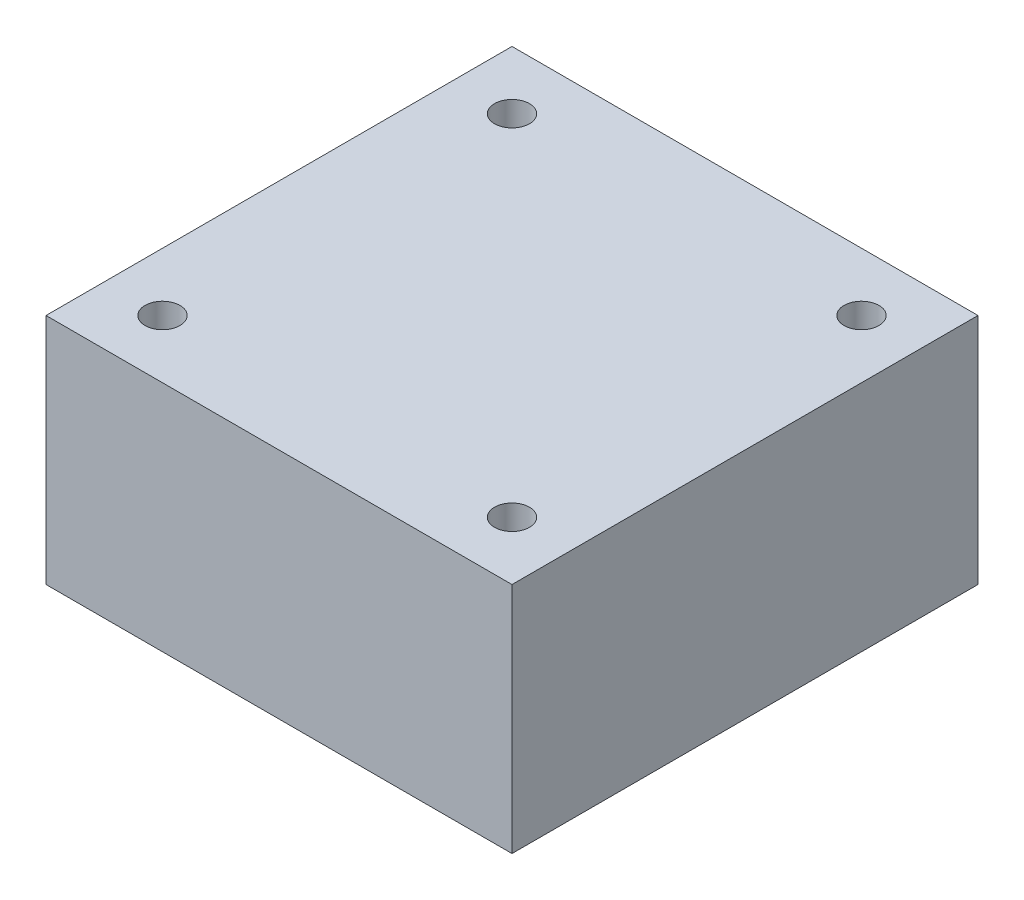
from build123d import *

# Parameters (mm, degrees)
SKETCH1_W           = 40
SKETCH1_H           = 40
SKETCH1_R           = 1.5
BOSS_EXTRUDE1_DEPTH = 20


with BuildPart() as part:
    # Sketch1 → Boss-Extrude1 (new body)
    with BuildSketch(Plane(origin=(0, 0, 0), x_dir=(1, 0, 0), z_dir=(0, 1, 0))):
        Rectangle(SKETCH1_W, SKETCH1_H)
        with Locations(Location((-15, 15, 0), (0, 0, 270))):
            Circle(SKETCH1_R, mode=Mode.SUBTRACT)
        with Locations(Location((15, 15, 0), (0, 0, 270))):
            Circle(SKETCH1_R, mode=Mode.SUBTRACT)
        with Locations(Location((15, -15, 0), (0, 0, 270))):
            Circle(SKETCH1_R, mode=Mode.SUBTRACT)
        with Locations(Location((-15, -15, 0), (0, 0, 270))):
            Circle(SKETCH1_R, mode=Mode.SUBTRACT)
    extrude(amount=BOSS_EXTRUDE1_DEPTH)


solid = part.part
